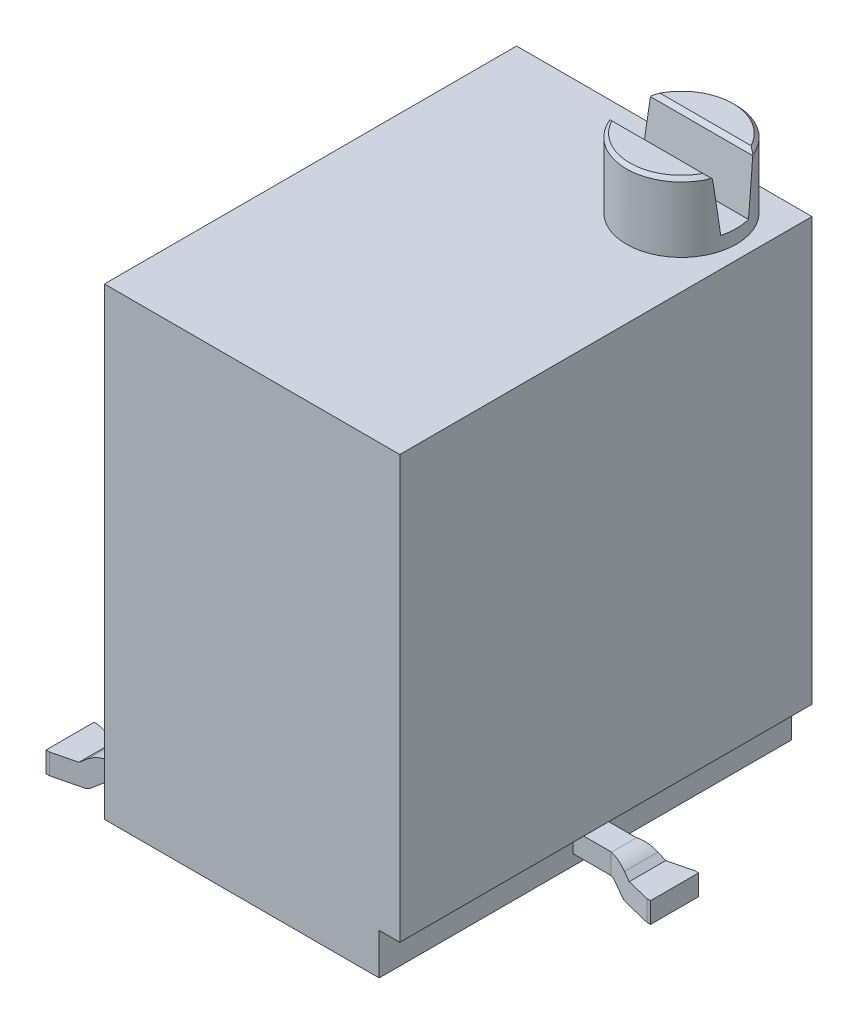
from build123d import *
from OCP.BRepFilletAPI import BRepFilletAPI_MakeChamfer

# Parameters (mm, degrees)
SKETCH1_W           = 4.3
SKETCH1_H           = 6
BOSS_EXTRUDE1_DEPTH = 6.75
SKETCH2_R           = 0.8
BOSS_EXTRUDE2_DEPTH = 1
SKETCH3_W           = 1.811917262
SKETCH3_H           = 0.6
CUT_EXTRUDE2_DEPTH  = 0.8
CUT_EXTRUDE2_DRAFT  = -7
CHAMFER1_SIZE       = 0.05
CHAMFER1_SIZE2      = 0.05742659
BOSS_EXTRUDE3_DEPTH = 6
CUT_EXTRUDE5_DEPTH  = 0.8
SKETCH9_W           = 0.3
SKETCH9_H           = 0.6
CUT_EXTRUDE7_DEPTH  = 11.294901651
SKETCH10_W          = 0.362580834
SKETCH10_H          = 0.3
BOSS_EXTRUDE4_DEPTH = 0.3


with BuildPart() as part:
    # Sketch1 → Boss-Extrude1 (new body)
    with BuildSketch(Plane(origin=(0, 0, 0), x_dir=(1, 0, 0), z_dir=(0, 1, 0))):
        Rectangle(SKETCH1_W, SKETCH1_H)
    extrude(amount=BOSS_EXTRUDE1_DEPTH)

    # Sketch2 → Boss-Extrude2 (add)
    with BuildSketch(Plane(origin=(0, 6.75, 0), x_dir=(1, 0, 0), z_dir=(0, 1, 0))):
        with Locations(Location((1.15, 2.1, 0), (0, 0, 270))):
            Circle(SKETCH2_R)
    extrude(amount=BOSS_EXTRUDE2_DEPTH)


with BuildPart() as cut_extrude2_tool:
    # Sketch3 → Cut-Extrude2 (with draft: the straight prism first)
    with BuildSketch(Plane(origin=(0, 7.75, 0), x_dir=(1, 0, 0), z_dir=(0, 1, 0))):
        with Locations((1.15, 2.1)):
            Rectangle(SKETCH3_W, SKETCH3_H)
    extrude(amount=-CUT_EXTRUDE2_DEPTH)
    # Cut-Extrude2: the draft: its side faces are tilted about the plane it starts from
    cut_extrude2_sides = [cut_extrude2_tool.faces().sort_by_distance(p)[0] for p in [
        (1.15, 7.35, -2.4),
        (0.244041369, 7.35, -2.1),
        (1.15, 7.35, -1.8),
        (2.055958631, 7.35, -2.1),
    ]]
    draft(cut_extrude2_sides, Plane(origin=(0, 7.75, 0), x_dir=(1, 0, 0), z_dir=(0, 1, 0)), CUT_EXTRUDE2_DRAFT)


with BuildPart() as part_1:
    add(part.part)

    # Cut-Extrude2: cut by cut_extrude2_tool
    add(cut_extrude2_tool.part, mode=Mode.SUBTRACT)

    # Chamfer1: one chamfer whose edges measure the first distance from different faces: ONE call of the kernel's chamfer builder (chamfer() names one face for all edges)
    chamfer1_edges_1 = [part_1.edges().sort_by_distance(p)[0] for p in [
        (1.15, 7.75, -2.4),
    ]]
    chamfer1_side_1 = [part_1.faces().sort_by_distance(p)[0] for p in [
        (1.15, 7.75, -2.606561726),
    ]]
    chamfer1_edges_2 = [part_1.edges().sort_by_distance(p)[0] for p in [
        (1.15, 7.75, -1.8),
    ]]
    chamfer1_side_2 = [part_1.faces().sort_by_distance(p)[0] for p in [
        (1.15, 7.75, -1.593438274),
    ]]
    chamfer1_edges_3 = [part_1.edges().sort_by_distance(p)[0] for p in [
        (1.597213595, 7.75, -1.436675042),
        (1.15, 7.75, -2.9),
    ]]
    chamfer1 = BRepFilletAPI_MakeChamfer(part_1.part.solid().wrapped)
    for e in chamfer1_edges_1:
        chamfer1.Add(CHAMFER1_SIZE, CHAMFER1_SIZE2, e.wrapped, chamfer1_side_1[0].wrapped)  # the first distance lies on this face
    for e in chamfer1_edges_2:
        chamfer1.Add(CHAMFER1_SIZE, CHAMFER1_SIZE2, e.wrapped, chamfer1_side_2[0].wrapped)  # the first distance lies on this face
    for e in chamfer1_edges_3:
        chamfer1.Add(CHAMFER1_SIZE, e.wrapped)
    add(Compound.cast(chamfer1.Shape()), mode=Mode.REPLACE)


with BuildPart() as body_2:
    # Sketch6 → Boss-Extrude3 (new, through all)
    with BuildSketch(Plane.XY.offset(3)):
        with BuildLine():
            Line((-2.15, 0.160165276), (-2.414893608, 0.160165276))
            ThreePointArc((-2.414893608, 0.160165276), (-2.448018066, 0.154519768), (-2.477402436, 0.138220682))
            Line((-2.477402436, 0.138220682), (-2.622597564, 0.021944594))
            ThreePointArc((-2.622597564, 0.021944594), (-2.651981934, 0.005645507), (-2.685106392, 0))
            Line((-2.685106392, 0), (-3.15, 0))
            Line((-3.15, 0), (-3.15, 0.3))
            Line((-3.15, 0.3), (-2.755319175, 0.3))
            Line((-2.755319175, 0.3), (-2.664928921, 0.3723869))
            ThreePointArc((-2.664928921, 0.3723869), (-2.547391439, 0.437583247), (-2.414893608, 0.460165276))
            Line((-2.414893608, 0.460165276), (-2.15, 0.460165276))
            Line((-2.15, 0.460165276), (-2.15, 0.160165276))
        make_face()
    boss_extrude3 = extrude(amount=-BOSS_EXTRUDE3_DEPTH)


with BuildPart() as part_2:
    add(part_1.part)

    # Mirror8: Boss-Extrude3 across plane
    add(boss_extrude3.mirror(Plane(origin=(0, 0, 0), x_dir=(0, 0, 1), z_dir=(1, 0, 0))))


with BuildPart() as cut_extrude5_tool:
    # Sketch7 → Cut-Extrude5 (new body)
    with BuildSketch(Plane.XZ):
        Polygon((-2.15, -2.318709583), (-2.15, 2.318709583), (-2.407647713, 2.318709583), (-3.09799799, 2.15), (-3.15, 2.15), (-3.15, -2.15), (-3.09799799, -2.15), (-2.407647713, -2.318709583), align=None)
        Polygon((-3.15, 2.85), (-3.09799799, 2.85), (-2.407647713, 2.681290417), (-2.15, 2.681290417), (-2.15, 3), (-3.15, 3), align=None)
        Polygon((-2.15, -3), (-2.15, -2.681290417), (-2.407647713, -2.681290417), (-3.09799799, -2.85), (-3.15, -2.85), (-3.15, -3), align=None)
        Polygon((2.407647713, -0.181290417), (2.15, -0.181290417), (2.15, -3), (3.15, -3), (3.15, -0.35), (3.09799799, -0.35), align=None)
        Polygon((2.15, 3), (2.15, 0.181290417), (2.407647713, 0.181290417), (3.09799799, 0.35), (3.15, 0.35), (3.15, 3), align=None)
    extrude(amount=-CUT_EXTRUDE5_DEPTH)


with BuildPart() as part_3:
    add(part_2.part)

    # Cut-Extrude5: cut by cut_extrude5_tool
    add(cut_extrude5_tool.part, mode=Mode.SUBTRACT)

    # Sketch9 → Cut-Extrude7 (cut, through all)
    with BuildSketch(Plane.XY.offset(3)):
        with Locations((2, 0.3)):
            Rectangle(SKETCH9_W, SKETCH9_H)
    extrude(amount=-CUT_EXTRUDE7_DEPTH, mode=Mode.SUBTRACT)


with BuildPart() as body_2_1:
    add(body_2.part)

    # Cut-Extrude5: cut by cut_extrude5_tool
    add(cut_extrude5_tool.part, mode=Mode.SUBTRACT)


with BuildPart() as cut_extrude7_piece_1:
    # of the separate pieces the step leaves, piece 1, a body of its own (cut_extrude7_pieces)
    add(part_3.part.solids().sort_by_distance((1.15, 7.7, -1.3))[0])



with BuildPart() as cut_extrude7_piece_2:
    # of the separate pieces the step leaves, piece 2, a body of its own (cut_extrude7_pieces)
    add(part_3.part.solids().sort_by_distance((2.414893608, 0.460165276, 0.183061188))[0])


with BuildPart() as cut_extrude7_piece_1_1:
    add(cut_extrude7_piece_1.part)

    add(cut_extrude7_piece_2.part)  # Boss-Extrude4 merges Cut-Extrude7 piece 2
    # Sketch10 → Boss-Extrude4 (add)
    with BuildSketch(Plane.ZY.offset(-2.15)):
        with Locations((0, 0.310165276)):
            Rectangle(SKETCH10_W, SKETCH10_H)
    extrude(amount=BOSS_EXTRUDE4_DEPTH)


solid = Compound([body_2_1.part, cut_extrude7_piece_1_1.part])
